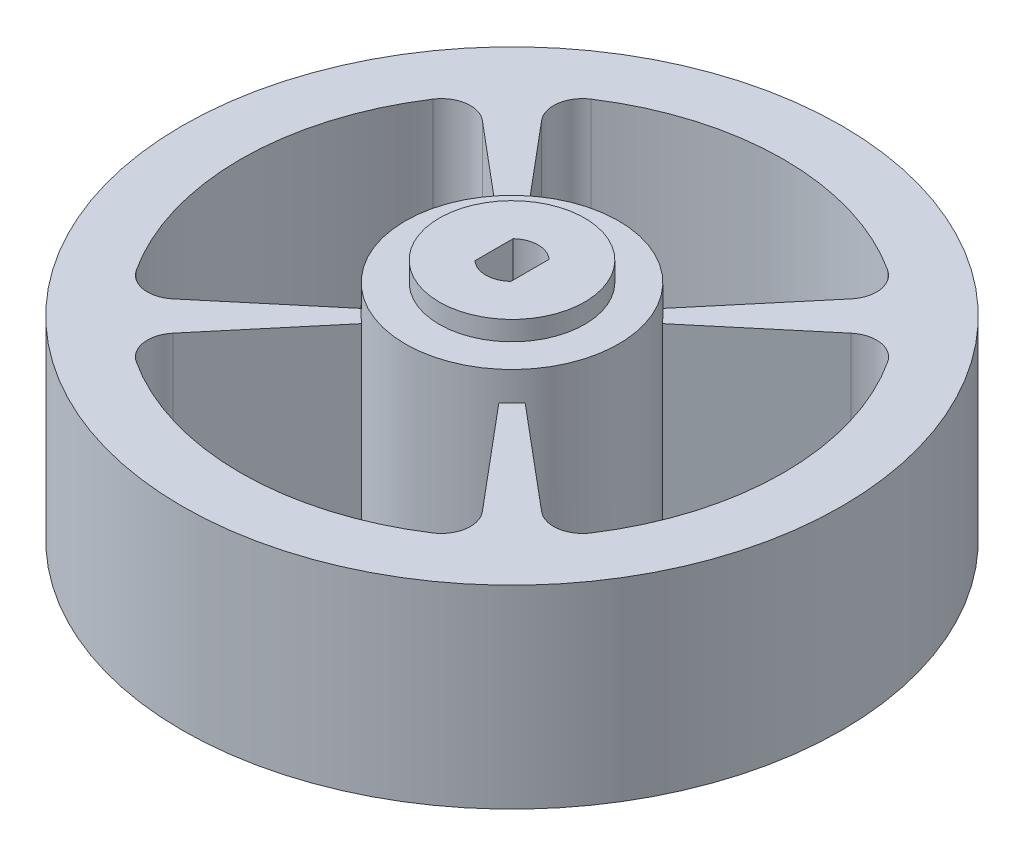
from build123d import *

# Parameters (mm, degrees)
SKETCH_1_R          = 34
SKETCH_1_R_2        = 11
EXTRUDE_1_DEPTH     = 10
SKETCH_1_3_R        = 11
SKETCH_1_3_R_2      = 7.5
EXTRUDE_2_DEPTH     = 13
SKETCH_1_4_R        = 7.5
SKETCH_1_4_R_2      = 2.7
EXTRUDE_3_DEPTH     = 15
EXTRUDE_START       = -10
SKETCH_1_6_R        = 11
SKETCH_1_6_R_2      = 7.5
SKETCH_1_6_R_3      = 2.7
EXTRUDE_4_DEPTH     = 10
CUT_EXTRUDE_1_DEPTH = 53.076866265


with BuildPart() as part:
    # 草图1 → 凸台-拉伸1 (new, symmetric)
    with BuildSketch(Plane(origin=(0, 0, 0), x_dir=(1, 0, 0), z_dir=(0, 1, 0))):
        with Locations(Location((0, 0, 0), (0, 0, 270))):
            Circle(SKETCH_1_R)
        with Locations(Location((0, 0, 0), (0, 0, 270))):
            Circle(SKETCH_1_R_2, mode=Mode.SUBTRACT)
    extrude(amount=EXTRUDE_1_DEPTH, both=True)

    # 草图1<3> → 凸台-拉伸2 (add)
    with BuildSketch(Plane(origin=(0, 0, 0), x_dir=(1, 0, 0), z_dir=(0, 1, 0))):
        with Locations(Location((0, 0, 0), (0, 0, 270))):
            Circle(SKETCH_1_3_R)
        with Locations(Location((0, 0, 0), (0, 0, 90))):
            Circle(SKETCH_1_3_R_2, mode=Mode.SUBTRACT)
    extrude(amount=EXTRUDE_2_DEPTH)

    # 草图1<4> → 凸台-拉伸3 (add)
    # profile 1 of 3: a face of its own
    with BuildSketch(Plane(origin=(0, 0, 0), x_dir=(1, 0, 0), z_dir=(0, 1, 0))):
        with Locations(Location((0, 0, 0), (0, 0, 270))):
            Circle(SKETCH_1_4_R)
        Circle(SKETCH_1_4_R_2, mode=Mode.SUBTRACT)
    # profile 2 of 3: a face of its own
    with BuildSketch(Plane(origin=(0, 0, 0), x_dir=(1, 0, 0), z_dir=(0, 1, 0))):
        with BuildLine():
            ThreePointArc((2.7, 0), (2.478406746, 1.071214264), (1.85, 1.966596044))
            Line((1.85, 1.966596044), (1.85, -1.966596044))
            ThreePointArc((1.85, -1.966596044), (2.478406746, -1.071214264), (2.7, 0))
        make_face()
    # profile 3 of 3: a face of its own
    with BuildSketch(Plane(origin=(0, 0, 0), x_dir=(1, 0, 0), z_dir=(0, 1, 0))):
        with BuildLine():
            Line((-1.85, -1.966596044), (-1.85, 1.966596044))
            ThreePointArc((-1.85, 1.966596044), (-2.7, 0), (-1.85, -1.966596044))
        make_face()
    extrude(amount=EXTRUDE_3_DEPTH)

    # 草图1<6> → 凸台-拉伸4 (add)
    # profile 1 of 4: a face of its own
    with BuildSketch(Plane(origin=(0, 0, 0), x_dir=(1, 0, 0), z_dir=(0, 1, 0)).offset(EXTRUDE_START)):
        with Locations(Location((0, 0, 0), (0, 0, 90))):
            Circle(SKETCH_1_6_R)
        with Locations(Location((0, 0, 0), (0, 0, 270))):
            Circle(SKETCH_1_6_R_2, mode=Mode.SUBTRACT)
    # profile 2 of 4: a face of its own
    with BuildSketch(Plane(origin=(0, 0, 0), x_dir=(1, 0, 0), z_dir=(0, 1, 0)).offset(EXTRUDE_START)):
        with Locations(Location((0, 0, 0), (0, 0, 270))):
            Circle(SKETCH_1_6_R_2)
        Circle(SKETCH_1_6_R_3, mode=Mode.SUBTRACT)
    # profile 3 of 4: a face of its own
    with BuildSketch(Plane(origin=(0, 0, 0), x_dir=(1, 0, 0), z_dir=(0, 1, 0)).offset(EXTRUDE_START)):
        with BuildLine():
            Line((-1.85, -1.966596044), (-1.85, 1.966596044))
            ThreePointArc((-1.85, 1.966596044), (-2.7, 0), (-1.85, -1.966596044))
        make_face()
    # profile 4 of 4: a face of its own
    with BuildSketch(Plane(origin=(0, 0, 0), x_dir=(1, 0, 0), z_dir=(0, 1, 0)).offset(EXTRUDE_START)):
        with BuildLine():
            ThreePointArc((2.7, 0), (2.478406746, 1.071214264), (1.85, 1.966596044))
            Line((1.85, 1.966596044), (1.85, -1.966596044))
            ThreePointArc((1.85, -1.966596044), (2.478406746, -1.071214264), (2.7, 0))
        make_face()
    extrude(amount=EXTRUDE_4_DEPTH)

    # 草图2 → 切除-拉伸1 (cut, through all)
    with BuildSketch(Plane(origin=(0, 10, 0), x_dir=(1, 0, 0), z_dir=(0, 1, 0))):
        with BuildLine():
            Line((-7.070663707, 8.426488874), (-15.95356892, 19.012723075))
            ThreePointArc((-15.95356892, 19.012723075), (-16.62289939, 21.381720221), (-15.294087861, 23.454016212))
            ThreePointArc((-15.294087861, 23.454016212), (0, 28), (15.294087861, 23.454016212))
            ThreePointArc((15.294087861, 23.454016212), (16.62289939, 21.381720221), (15.95356892, 19.012723075))
            Line((15.95356892, 19.012723075), (7.070663707, 8.426488874))
            ThreePointArc((7.070663707, 8.426488874), (0, 11), (-7.070663707, 8.426488874))
        make_face()
        with BuildLine():
            Line((8.426488874, -7.070663707), (19.012723075, -15.95356892))
            ThreePointArc((19.012723075, -15.95356892), (21.381720221, -16.62289939), (23.454016212, -15.294087861))
            ThreePointArc((23.454016212, -15.294087861), (28, 0), (23.454016212, 15.294087861))
            ThreePointArc((23.454016212, 15.294087861), (21.381720221, 16.62289939), (19.012723075, 15.95356892))
            Line((19.012723075, 15.95356892), (8.426488874, 7.070663707))
            ThreePointArc((8.426488874, 7.070663707), (11, 0), (8.426488874, -7.070663707))
        make_face()
        with BuildLine():
            Line((-7.070663707, -8.426488874), (-15.95356892, -19.012723075))
            ThreePointArc((-15.95356892, -19.012723075), (-16.62289939, -21.381720221), (-15.294087861, -23.454016212))
            ThreePointArc((-15.294087861, -23.454016212), (0, -28), (15.294087861, -23.454016212))
            ThreePointArc((15.294087861, -23.454016212), (16.62289939, -21.381720221), (15.95356892, -19.012723075))
            Line((15.95356892, -19.012723075), (7.070663707, -8.426488874))
            ThreePointArc((7.070663707, -8.426488874), (0, -11), (-7.070663707, -8.426488874))
        make_face()
        with BuildLine():
            Line((-8.426488874, 7.070663707), (-19.012723075, 15.95356892))
            ThreePointArc((-19.012723075, 15.95356892), (-21.381720221, 16.62289939), (-23.454016212, 15.294087861))
            ThreePointArc((-23.454016212, 15.294087861), (-28, 0), (-23.454016212, -15.294087861))
            ThreePointArc((-23.454016212, -15.294087861), (-21.381720221, -16.62289939), (-19.012723075, -15.95356892))
            Line((-19.012723075, -15.95356892), (-8.426488874, -7.070663707))
            ThreePointArc((-8.426488874, -7.070663707), (-11, 0), (-8.426488874, 7.070663707))
        make_face()
    extrude(amount=-CUT_EXTRUDE_1_DEPTH, mode=Mode.SUBTRACT)


solid = part.part
